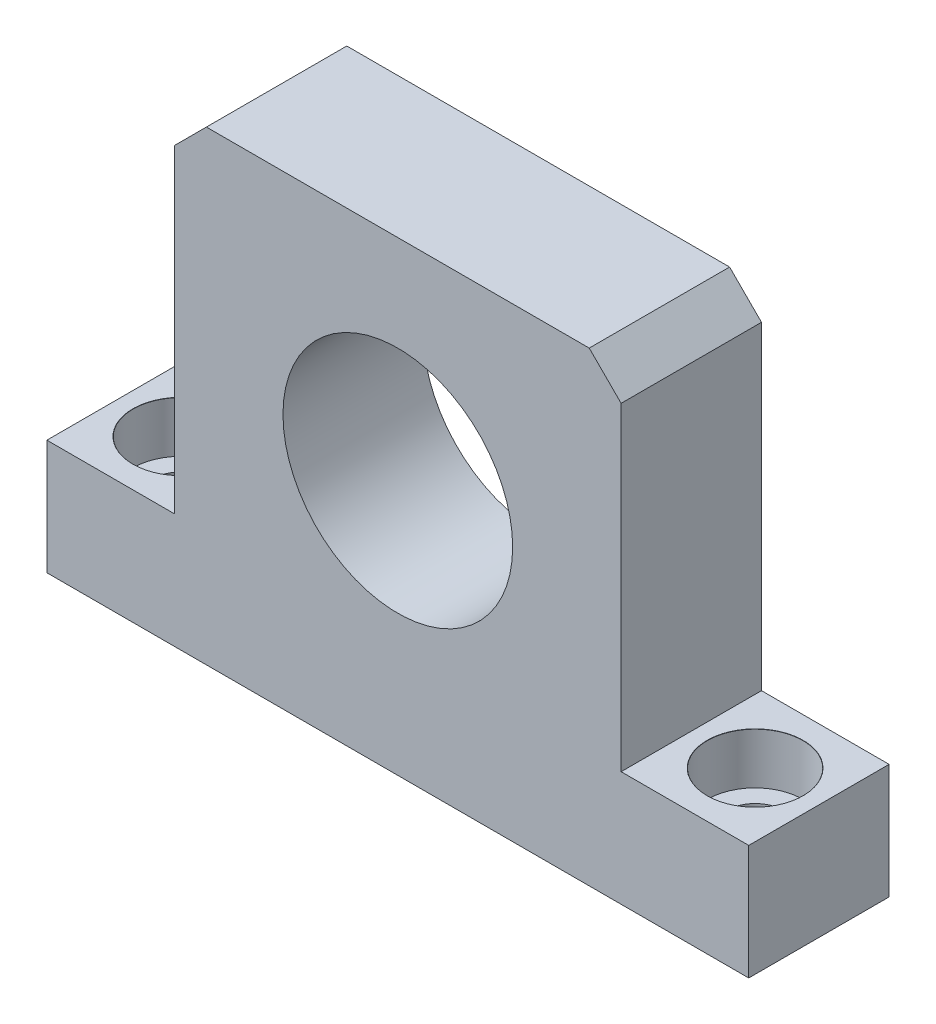
from build123d import *

# Parameters (mm, degrees)
SKETCH_1_R                  = 18
EXTRUDE_1_DEPTH             = 11
HOLE_WIZARD_M8_1_AT_2_COUNT = 2
HOLE_WIZARD_M8_1_AT_2_PITCH = 90
HOLE_WIZARD_M6_1_D          = 5
HOLE_WIZARD_M6_1_DEPTH      = 15
HOLE_WIZARD_M6_1_TIP        = 1.502151548


with BuildPart() as part:
    # 草图1 → 拉伸1 (new, symmetric)
    with BuildSketch(Plane.XY):
        Polygon((35, 18), (55, 18), (55, 0), (-55, 0), (-55, 18), (-35, 18), (-35, 68), (-30, 73), (30, 73), (35, 68), align=None)
        with Locations((0, 40)):
            Circle(SKETCH_1_R, mode=Mode.SUBTRACT)
    extrude(amount=EXTRUDE_1_DEPTH, both=True)

    # 草图2 → M8 六角凹头螺钉的柱形沉头孔1 (revolve, cut)
    with BuildSketch(Plane(origin=(-45, 18, 0), x_dir=(0, 0, 1), z_dir=(1, 0, 0))):
        Polygon((0, 0), (0, 18), (4.5, 18), (4.5, 8), (7.5, 8), (7.5, 0.025), (7.525, 0), align=None)
    hole_wizard_m8_1 = revolve(axis=Axis((-45, 24.35, 0), (0, -1, 0)), mode=Mode.SUBTRACT)

    # M8 六角凹头螺钉的柱形沉头孔1 at 2: M8 六角凹头螺钉的柱形沉头孔1 ×2
    with Locations(*[(i * HOLE_WIZARD_M8_1_AT_2_PITCH, 0, 0) for i in range(1, HOLE_WIZARD_M8_1_AT_2_COUNT)]):
        add(hole_wizard_m8_1, mode=Mode.SUBTRACT)

    # M6 螺纹孔1
    with Locations(Plane(origin=(0, 0, -11), x_dir=(-1, 0, 0), z_dir=(0, 0, -1))):
        with Locations((16.615900688, 25.382990642), (-16.618118028, 25.382990642), (-23.50110867, 42), (-16.618118028, 58.617009358), (16.615900688, 58.617009358), (23.49889133, 42)):
            Hole(HOLE_WIZARD_M6_1_D / 2, depth=HOLE_WIZARD_M6_1_DEPTH)
            with Locations((0, 0, -(HOLE_WIZARD_M6_1_DEPTH + HOLE_WIZARD_M6_1_TIP / 2))):  # 118° drill point
                Cone(0, HOLE_WIZARD_M6_1_D / 2, HOLE_WIZARD_M6_1_TIP, mode=Mode.SUBTRACT)


solid = part.part
